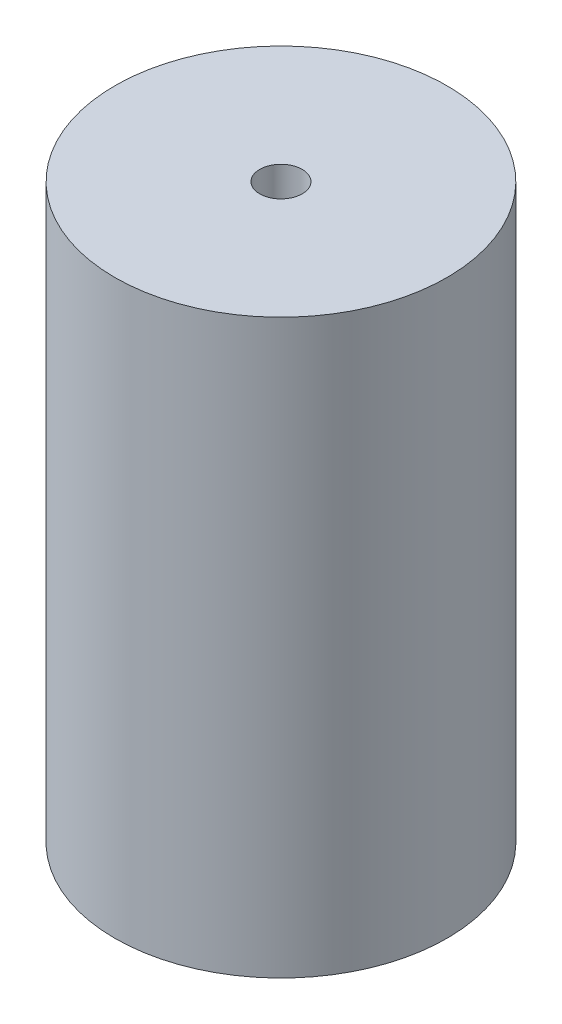
from build123d import *

# Parameters (mm, degrees)
SKETCH1_R           = 69.85
BOSS_EXTRUDE1_DEPTH = 12.7
SKETCH1_3_R         = 69.85
SKETCH1_3_R_2       = 63.5
BOSS_EXTRUDE2_DEPTH = 227.965
SKETCH2_R           = 69.85
BOSS_EXTRUDE3_DEPTH = 12.7
SKETCH3_R           = 8.9296875
CUT_EXTRUDE1_DEPTH  = 335.534


with BuildPart() as part:
    # Sketch1 → Boss-Extrude1 (new body)
    with BuildSketch(Plane(origin=(0, 0, 0), x_dir=(1, 0, 0), z_dir=(0, 1, 0))):
        Circle(SKETCH1_R)
    extrude(amount=BOSS_EXTRUDE1_DEPTH)

    # Sketch1<3> → Boss-Extrude2 (add)
    with BuildSketch(Plane(origin=(0, 0, 0), x_dir=(1, 0, 0), z_dir=(0, 1, 0))):
        Circle(SKETCH1_3_R)
        Circle(SKETCH1_3_R_2, mode=Mode.SUBTRACT)
    extrude(amount=BOSS_EXTRUDE2_DEPTH)

    # Sketch2 → Boss-Extrude3 (add)
    with BuildSketch(Plane(origin=(0, 227.965, 0), x_dir=(1, 0, 0), z_dir=(0, 1, 0))):
        Circle(SKETCH2_R)
    extrude(amount=BOSS_EXTRUDE3_DEPTH)

    # Sketch3 → Cut-Extrude1 (cut)
    with BuildSketch(Plane(origin=(0, 240.665, 0), x_dir=(1, 0, 0), z_dir=(0, 1, 0))):
        Circle(SKETCH3_R)
    extrude(amount=-CUT_EXTRUDE1_DEPTH, mode=Mode.SUBTRACT)


solid = part.part
